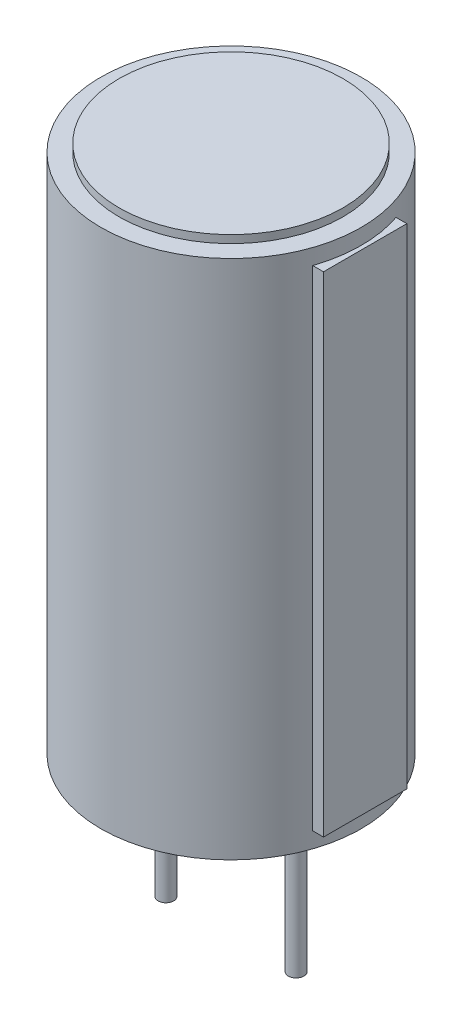
from build123d import *

# Parameters (mm, degrees)
SK_CAN_R           = 5
CAN_DEPTH          = 20
TOP_START          = 20
SK_TOP_DISC_R      = 4.3
TOP_DISC_DEPTH     = 0.3
MINUS_START        = 0.6
SK_MINUS_STRIPE_W  = 0.55
SK_MINUS_STRIPE_H  = 3.2
MINUS_STRIPE_DEPTH = 18.8
LEADS_START        = -6
SK_LEADS_R         = 0.3
LEADS_DEPTH        = 6
LEADS_2_DEPTH      = 6


with BuildPart() as part:
    # SK Can → Can (new body)
    with BuildSketch(Plane(origin=(0, 0, 0), x_dir=(1, 0, 0), z_dir=(0, 1, 0))):
        with Locations(Location((0, 0, 0), (0, 0, 270))):
            Circle(SK_CAN_R)
    extrude(amount=CAN_DEPTH)


with BuildPart() as body_2:
    # SK Top disc → Top disc (new body)
    with BuildSketch(Plane(origin=(0, 0, 0), x_dir=(1, 0, 0), z_dir=(0, 1, 0)).offset(TOP_START)):
        with Locations(Location((0, 0, 0), (0, 0, 270))):
            Circle(SK_TOP_DISC_R)
    extrude(amount=TOP_DISC_DEPTH)


with BuildPart() as body_3:
    # SK Minus stripe → Minus stripe (new body)
    with BuildSketch(Plane(origin=(0, 0, 0), x_dir=(1, 0, 0), z_dir=(0, 1, 0)).offset(MINUS_START)):
        with Locations((4.875, 0)):
            Rectangle(SK_MINUS_STRIPE_W, SK_MINUS_STRIPE_H)
    extrude(amount=MINUS_STRIPE_DEPTH)


with BuildPart() as body_4:
    # SK Leads → Leads (new body)
    with BuildSketch(Plane(origin=(0, 0, 0), x_dir=(1, 0, 0), z_dir=(0, 1, 0)).offset(LEADS_START)):
        with Locations(Location((-2.5, 0, 0), (0, 0, 270))):
            Circle(SK_LEADS_R)
    extrude(amount=LEADS_DEPTH)


with BuildPart() as body_5:
    # SK Leads → Leads 2 (new body)
    with BuildSketch(Plane(origin=(0, 0, 0), x_dir=(1, 0, 0), z_dir=(0, 1, 0)).offset(LEADS_START)):
        with Locations(Location((2.5, 0, 0), (0, 0, 270))):
            Circle(SK_LEADS_R)
    extrude(amount=LEADS_2_DEPTH)


solid = Compound([part.part, body_2.part, body_3.part, body_4.part, body_5.part])
